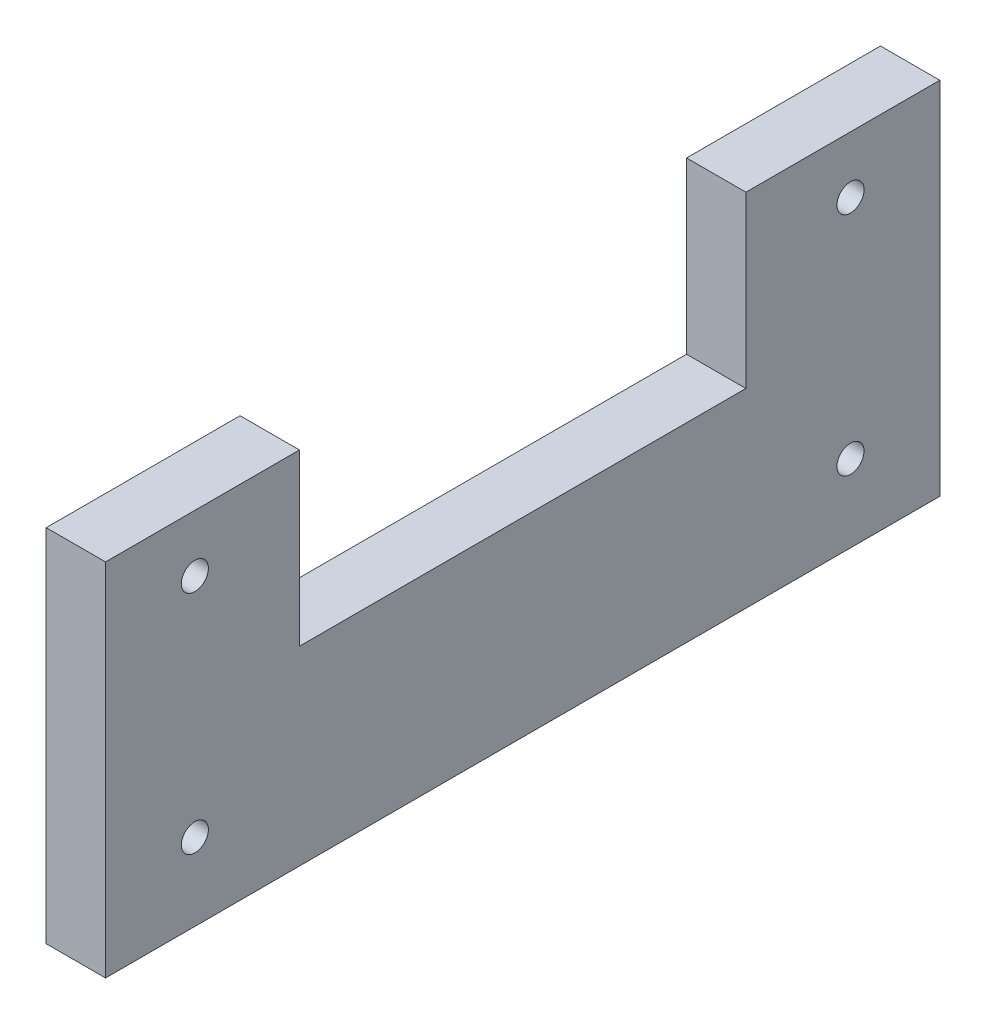
from build123d import *

# Parameters (mm, degrees)
SKETCH1_W           = 41.507340187
SKETCH1_H           = 36.387640449
BOSS_EXTRUDE1_DEPTH = 12.7
SKETCH2_R           = 2.899735459
CUT_EXTRUDE1_DEPTH  = 99.974975464


with BuildPart() as part:
    # Sketch1 → Boss-Extrude1 (new body)
    with BuildSketch(Plane(origin=(0, 0, 0), x_dir=(0, 0, -1), z_dir=(1, 0, 0))):
        with Locations((20.753670094, 18.193820225)):
            Rectangle(SKETCH1_W, SKETCH1_H)
        Polygon((41.507340187, 0), (0, 0), (0, -40.754157303), (89.29644131, -40.754157303), (89.29644131, 0), align=None)
    extrude(amount=BOSS_EXTRUDE1_DEPTH)

    # Sketch2 → Cut-Extrude1 (cut, through all)
    with BuildSketch(Plane(origin=(12.7, 0, 0), x_dir=(0, 0, -1), z_dir=(1, 0, 0))):
        with Locations((19.12019242, 24.225046644)):
            Circle(SKETCH2_R)
    cut_extrude1 = extrude(amount=-CUT_EXTRUDE1_DEPTH, mode=Mode.SUBTRACT)

    # Mirror1: Cut-Extrude1 across plane
    add(cut_extrude1.mirror(Plane.ZX), mode=Mode.SUBTRACT)

    # Mirror2: part across plane


with BuildPart() as part_1:
    add(part.part)
    add(part.part.mirror(Plane(origin=(12.7, 0, -89.29644131), x_dir=(1, 0, 0), z_dir=(0, 0, -1))))


solid = part_1.part
